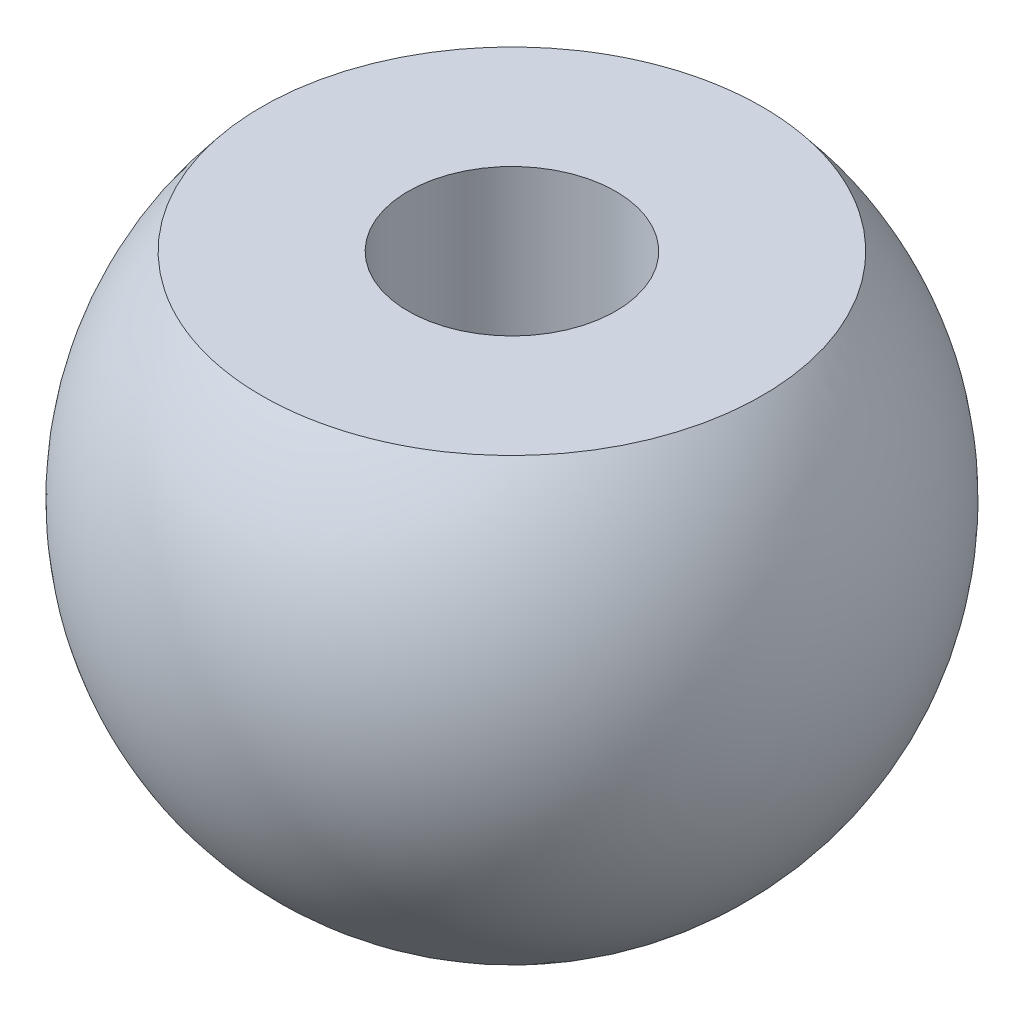
from build123d import *

# Parameters (mm, degrees)
CUT_EXTRUDE1_DEPTH      = 18.320508076
CUT_EXTRUDE1_DEPTH_BACK = 18.320508076
SKETCH2_R               = 3.15
CUT_EXTRUDE2_DEPTH      = 5
CUT_EXTRUDE3_START      = -20
SKETCH4_R               = 8
SKETCH4_R_2             = 3.15
CUT_EXTRUDE3_DEPTH      = 4


with BuildPart() as part:
    # Sketch1 → Revolve1 (revolve)
    with BuildSketch(Plane(origin=(0, 0, 0), x_dir=(1, 0, 0), z_dir=(0, 1, 0))):
        with BuildLine():
            Line((0, 10), (0, -10))
            ThreePointArc((0, -10), (10, 0), (0, 10))
        make_face()
    revolve(axis=Axis((0, 0, -10), (0, 0, 1)))

    # Sketch2 → Cut-Extrude1 (cut, two sides: drawn at the far end of the back side and taken through both)
    with BuildSketch(Plane(origin=(0, 0, 0), x_dir=(1, 0, 0), z_dir=(0, 1, 0)).offset(-CUT_EXTRUDE1_DEPTH_BACK)):
        with Locations(Location((0, 0, 0), (0, 0, 90))):
            Circle(SKETCH2_R)
    extrude(amount=CUT_EXTRUDE1_DEPTH + CUT_EXTRUDE1_DEPTH_BACK, mode=Mode.SUBTRACT)

    # Sketch3 → Cut-Extrude2 (cut)
    with BuildSketch(Plane(origin=(0, -9.49091671, 0), x_dir=(-1, 0, 0), z_dir=(0, -1, 0))):
        Polygon((0.2873335, -5.91086058), (5.26262217, -2.706592179), (4.97528867, 3.204268401), (-0.2873335, 5.91086058), (-5.26262217, 2.706592179), (-4.97528867, -3.204268401), align=None)
    extrude(amount=-CUT_EXTRUDE2_DEPTH, mode=Mode.SUBTRACT)

    # Sketch4 → Cut-Extrude3 (cut)
    with BuildSketch(Plane(origin=(0, -9.49091671, 0), x_dir=(-1, 0, 0), z_dir=(0, -1, 0)).offset(CUT_EXTRUDE3_START)):
        Circle(SKETCH4_R)
        with Locations(Location((0, 0, 0), (0, 0, 90))):
            Circle(SKETCH4_R_2, mode=Mode.SUBTRACT)
    extrude(amount=CUT_EXTRUDE3_DEPTH, mode=Mode.SUBTRACT)


solid = part.part
